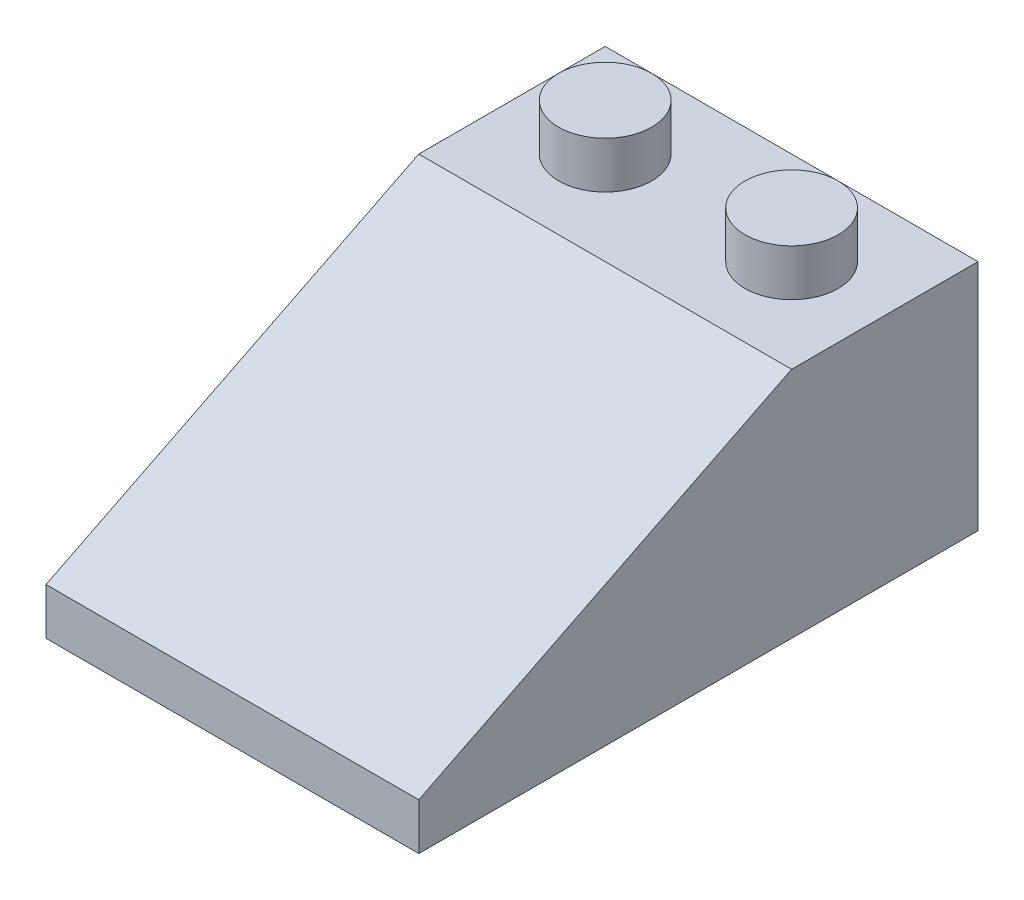
from build123d import *

# Parameters (mm, degrees)
BOSS_EXTRUDE1_DEPTH = 16
SKETCH2_R           = 2
BOSS_EXTRUDE2_DEPTH = 2
SHELL1_T            = -1
BOSS_EXTRUDE4_REACH = 33.241
SKETCH3_R           = 2.7
SKETCH3_R_2         = 1.7


with BuildPart() as part:
    # Sketch1 → Boss-Extrude1 (new body)
    with BuildSketch(Plane(origin=(0, 0, 0), x_dir=(0, 0, -1), z_dir=(1, 0, 0))):
        Polygon((-24, 0), (0, 0), (0, 10), (-8, 10), (-24, 2), align=None)
    extrude(amount=BOSS_EXTRUDE1_DEPTH)

    # Sketch2 → Boss-Extrude2 (add)
    with BuildSketch(Plane(origin=(0, 10, 0), x_dir=(1, 0, 0), z_dir=(0, 1, 0))):
        with Locations(Location((4, -4, 0), (0, 0, 90))):
            Circle(SKETCH2_R)
        with Locations(Location((12, -4, 0), (0, 0, 90))):
            Circle(SKETCH2_R)
    extrude(amount=BOSS_EXTRUDE2_DEPTH)

    # Shell1
    shell1_openings = [part.faces().sort_by_distance(p)[0] for p in [
        (8, 0, 12),
    ]]
    offset(amount=SHELL1_T, openings=shell1_openings, kind=Kind.INTERSECTION)

    # Sketch3 → Boss-Extrude4 (add, up to next)
    with BuildSketch(Plane.XZ, mode=Mode.PRIVATE) as boss_extrude4_sk1:
        with Locations(Location((8, 8, 0), (0, 0, 270))):
            Circle(SKETCH3_R)
        with Locations(Location((8, 8, 0), (0, 0, 270))):
            Circle(SKETCH3_R_2, mode=Mode.SUBTRACT)
    boss_extrude4_tool1 = extrude(boss_extrude4_sk1.sketch, amount=-BOSS_EXTRUDE4_REACH, mode=Mode.PRIVATE) - part.part
    # Sketch3 → Boss-Extrude4 (add, up to next)
    with BuildSketch(Plane.XZ, mode=Mode.PRIVATE) as boss_extrude4_sk2:
        with Locations(Location((8, 16, 0), (0, 0, 90))):
            Circle(SKETCH3_R)
        with Locations(Location((8, 16, 0), (0, 0, 90))):
            Circle(SKETCH3_R_2, mode=Mode.SUBTRACT)
    boss_extrude4_tool2 = extrude(boss_extrude4_sk2.sketch, amount=-BOSS_EXTRUDE4_REACH, mode=Mode.PRIVATE) - part.part
    add(boss_extrude4_tool1.solids().sort_by_distance((8, 0, 10.623632))[0])
    add(boss_extrude4_tool2.solids().sort_by_distance((8, 0, 13.376368))[0])


solid = part.part
